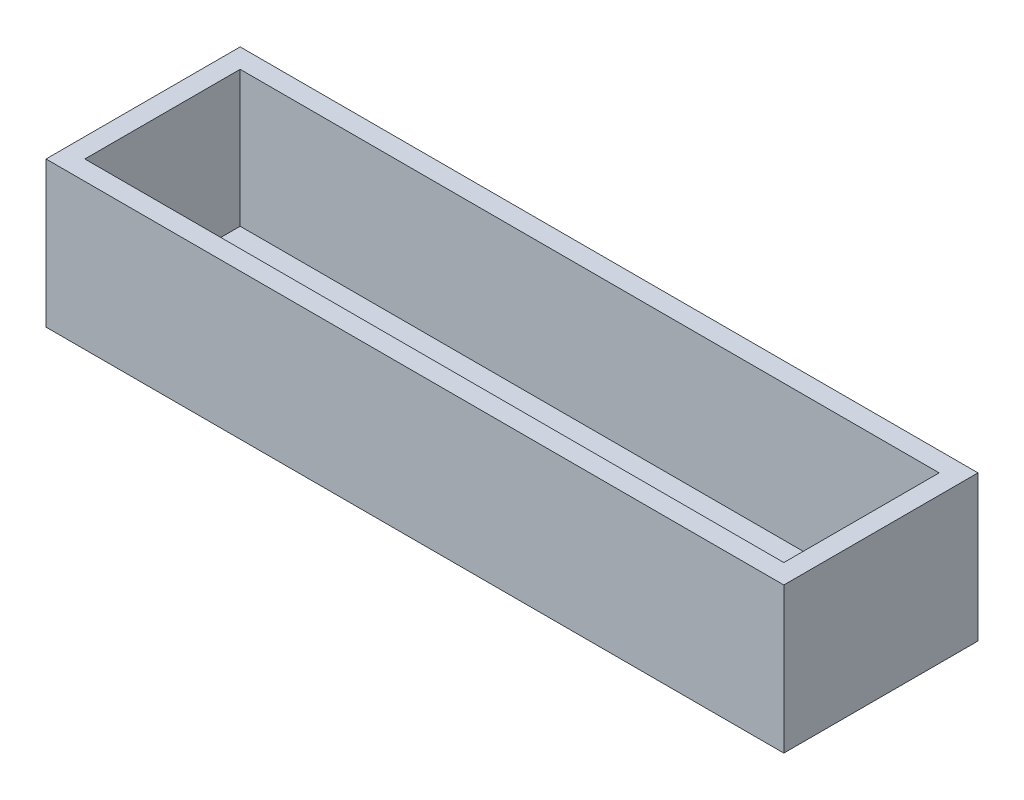
from build123d import *

# Parameters (mm, degrees)
SKETCH1_W           = 76
SKETCH1_H           = 20
BOSS_EXTRUDE1_DEPTH = 15
SKETCH2_W           = 72
SKETCH2_H           = 16
CUT_EXTRUDE1_DEPTH  = 14


with BuildPart() as part:
    # Sketch1 → Boss-Extrude1 (new body)
    with BuildSketch(Plane(origin=(0, 0, 0), x_dir=(1, 0, 0), z_dir=(0, 1, 0))):
        Rectangle(SKETCH1_W, SKETCH1_H)
    extrude(amount=BOSS_EXTRUDE1_DEPTH)

    # Sketch2 → Cut-Extrude1 (cut)
    with BuildSketch(Plane(origin=(0, 15, 0), x_dir=(1, 0, 0), z_dir=(0, 1, 0))):
        Rectangle(SKETCH2_W, SKETCH2_H)
    extrude(amount=-CUT_EXTRUDE1_DEPTH, mode=Mode.SUBTRACT)


solid = part.part
